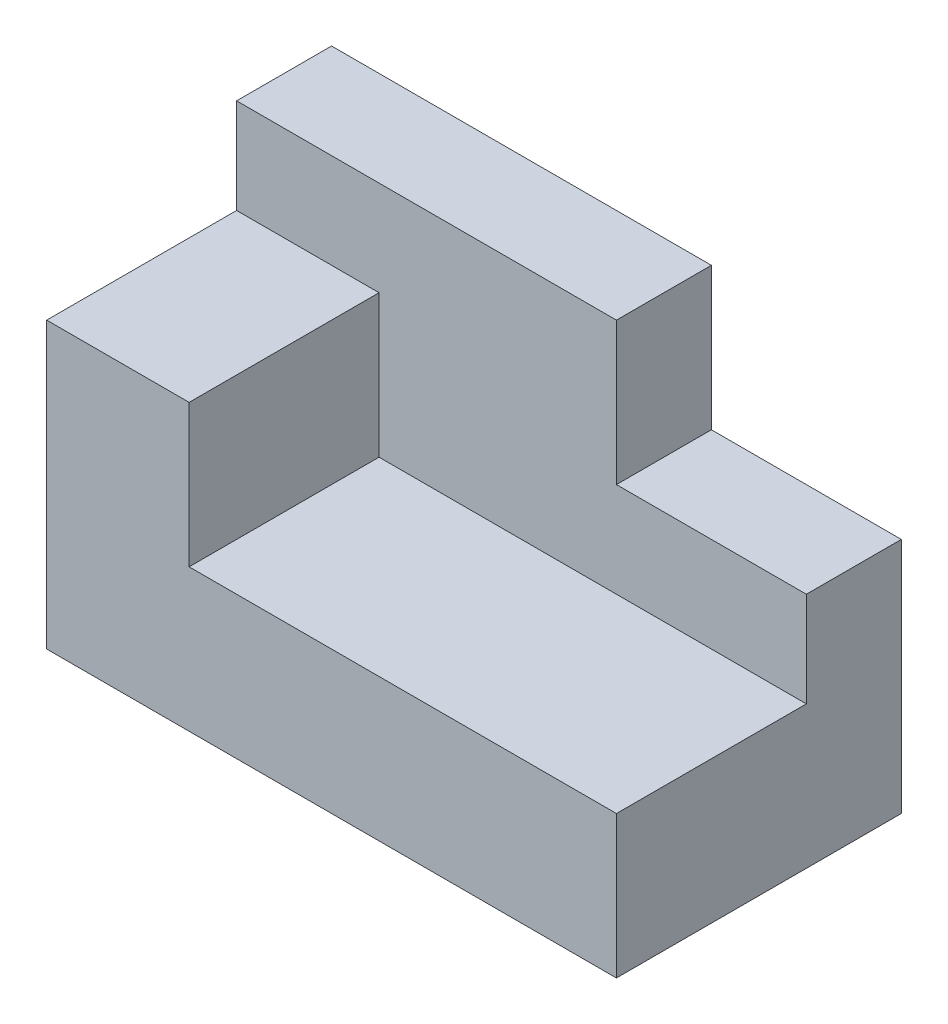
from build123d import *

# Parameters (mm, degrees)
RESSALTO_EXTRUS_O1_DEPTH = 30
ESBO_O2_W                = 25
ESBO_O2_H                = 20
CORTE_EXTRUS_O1_DEPTH    = 25
ESBO_O3_W                = 20
ESBO_O3_H                = 20
CORTE_EXTRUS_O2_DEPTH    = 10
ESBO_O4_W                = 15
ESBO_O4_H                = 20
CORTE_EXTRUS_O3_DEPTH    = 10


with BuildPart() as part:
    # Esboço1 → Ressalto-extrusão1 (new body)
    with BuildSketch(Plane.XY):
        Polygon((0, 0), (0, 40), (40, 40), (40, 25), (60, 25), (60, 0), align=None)
    extrude(amount=RESSALTO_EXTRUS_O1_DEPTH)

    # Esboço2 → Corte-extrusão1 (cut)
    with BuildSketch(Plane(origin=(0, 40, 0), x_dir=(1, 0, 0), z_dir=(0, 1, 0))):
        with Locations((27.5, -20)):
            Rectangle(ESBO_O2_W, ESBO_O2_H)
    extrude(amount=-CORTE_EXTRUS_O1_DEPTH, mode=Mode.SUBTRACT)

    # Esboço3 → Corte-extrusão2 (cut)
    with BuildSketch(Plane(origin=(0, 25, 0), x_dir=(1, 0, 0), z_dir=(0, 1, 0))):
        with Locations((50, -20)):
            Rectangle(ESBO_O3_W, ESBO_O3_H)
    extrude(amount=-CORTE_EXTRUS_O2_DEPTH, mode=Mode.SUBTRACT)

    # Esboço4 → Corte-extrusão3 (cut)
    with BuildSketch(Plane(origin=(0, 40, 0), x_dir=(1, 0, 0), z_dir=(0, 1, 0))):
        with Locations((7.5, -20)):
            Rectangle(ESBO_O4_W, ESBO_O4_H)
    extrude(amount=-CORTE_EXTRUS_O3_DEPTH, mode=Mode.SUBTRACT)


solid = part.part
